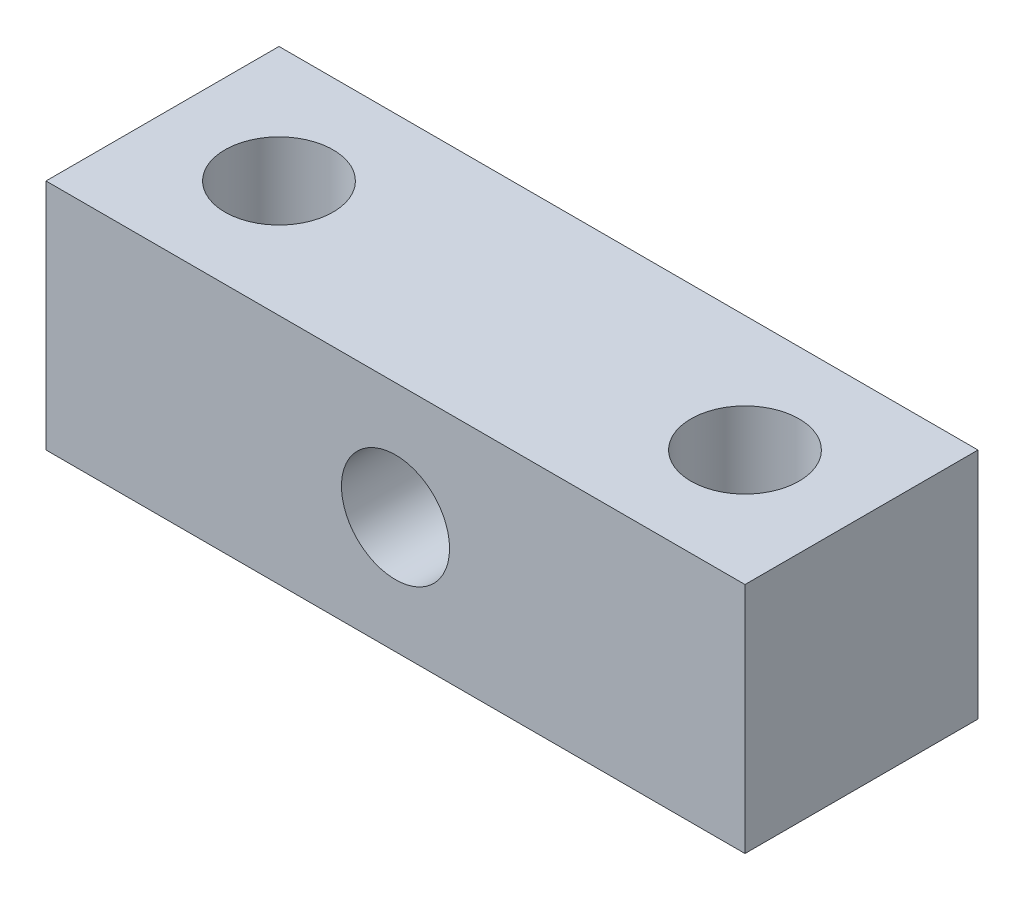
from build123d import *

# Parameters (mm, degrees)
SKETCH1_W             = 19.05
SKETCH1_H             = 6.35
BOSS_EXTRUDE1_DEPTH   = 6.35
F_4_CLEARANCE_HOLE1_D = 2.9464
F_4_CLEARANCE_HOLE2_D = 2.9464


with BuildPart() as part:
    # Sketch1 → Boss-Extrude1 (new body)
    with BuildSketch(Plane.XY):
        Rectangle(SKETCH1_W, SKETCH1_H)
    extrude(amount=BOSS_EXTRUDE1_DEPTH)

    # #4 Clearance Hole1 (through all)
    with Locations(Plane(origin=(0, 3.175, 0), x_dir=(1, 0, 0), z_dir=(0, 1, 0))):
        with Locations((-6.35, -3.175), (6.35, -3.175)):
            Hole(F_4_CLEARANCE_HOLE1_D / 2)

    # #4 Clearance Hole2 (through all)
    with Locations(Plane.XY.offset(6.35)):
        with Locations((0, 0)):
            Hole(F_4_CLEARANCE_HOLE2_D / 2)


solid = part.part
